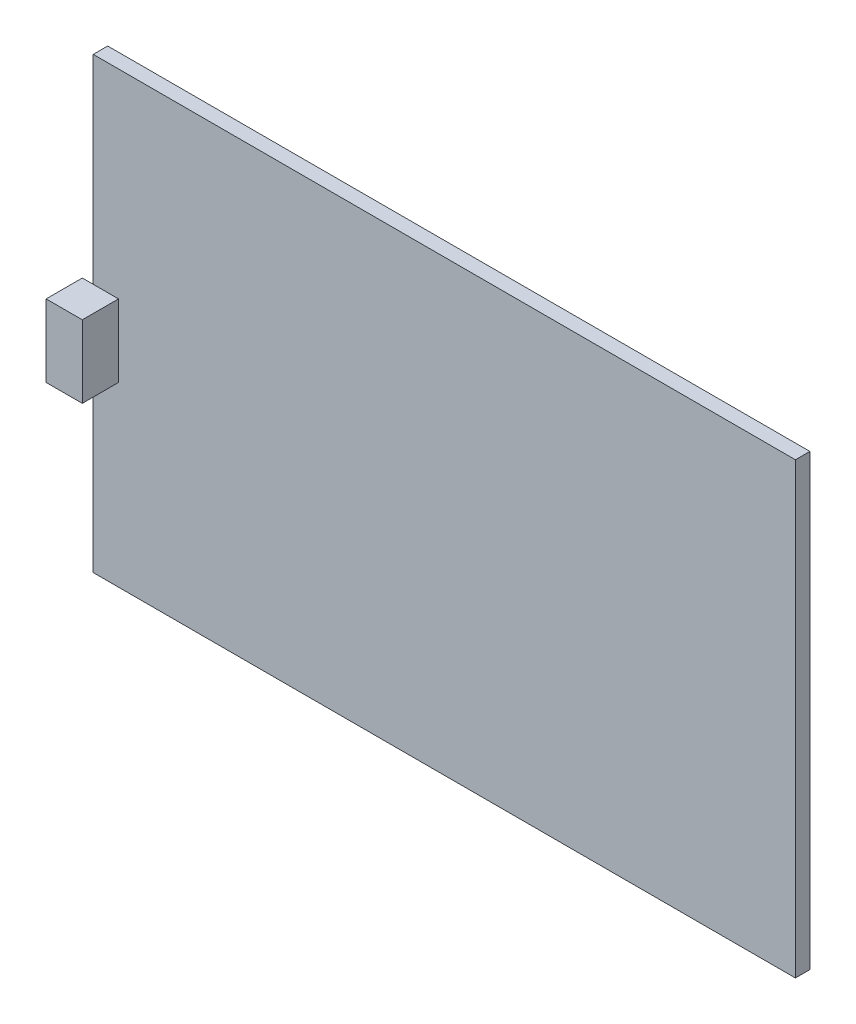
from build123d import *

# Parameters (mm, degrees)
ESQUISSE1_W        = 97
ESQUISSE1_H        = 62
BOSS_EXTRU_1_DEPTH = 2
ESQUISSE3_W        = 1.51
ESQUISSE3_H        = 3
BOSS_EXTRU_3_DEPTH = 1.51
ESQUISSE4_W        = 5
ESQUISSE4_H        = 10
BOSS_EXTRU_4_DEPTH = 5


with BuildPart() as part:
    # Esquisse1 → Boss.-Extru.1 (new body)
    with BuildSketch(Plane.XY):
        with Locations((0.382294712, -7.666666667)):
            Rectangle(ESQUISSE1_W, ESQUISSE1_H)
    extrude(amount=BOSS_EXTRU_1_DEPTH)

    # Esquisse3 → Boss.-Extru.3 (add)
    with BuildSketch(Plane.XY.offset(2)):
        with Locations((-47.362705288, -7.666666667)):
            Rectangle(ESQUISSE3_W, ESQUISSE3_H)
    extrude(amount=BOSS_EXTRU_3_DEPTH)

    # Esquisse4 → Boss.-Extru.4 (add)
    with BuildSketch(Plane.XY.offset(3.51)):
        with Locations((-45.617705288, -7.666666667)):
            Rectangle(ESQUISSE4_W, ESQUISSE4_H)
    extrude(amount=BOSS_EXTRU_4_DEPTH)


solid = part.part
